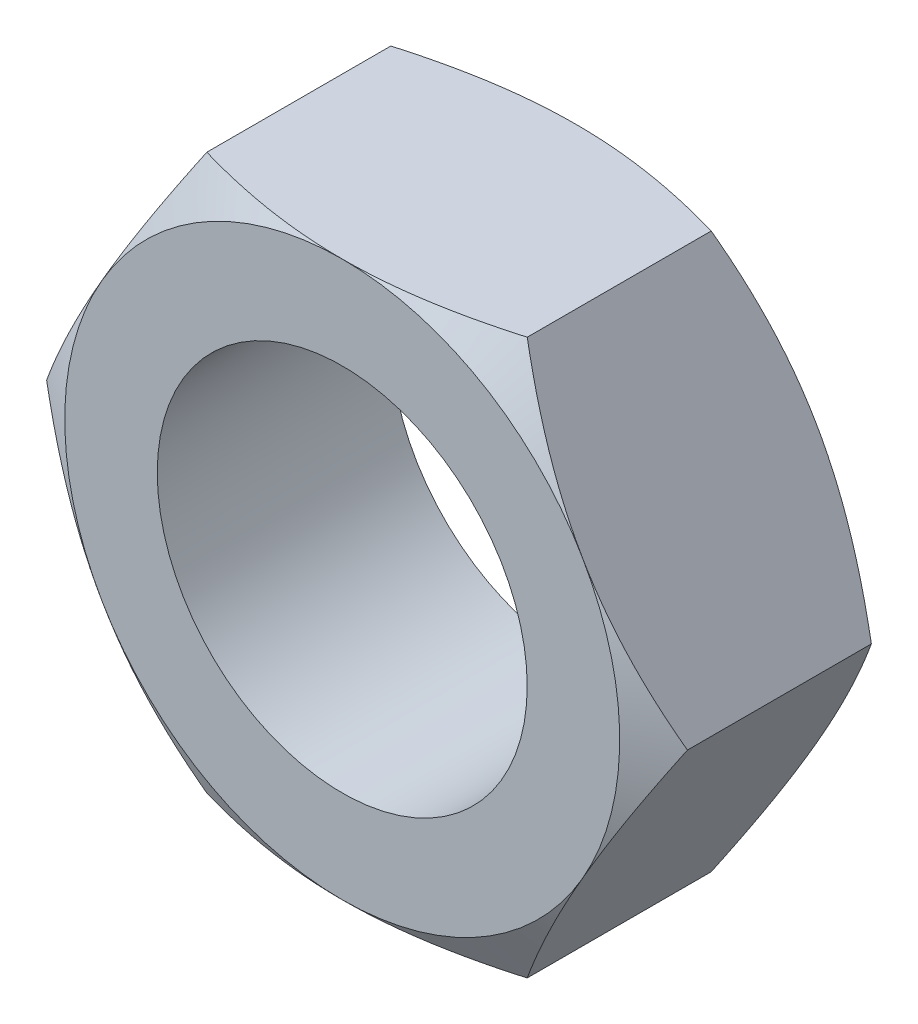
from build123d import *

# Parameters (mm, degrees)
BOSS_EXTRUDE1_DEPTH = 10.1
SKETCH2_OUTSIDE_W   = 113.28
SKETCH2_OUTSIDE_H   = 109.568
SKETCH2_OUTSIDE_R   = 12
CUT_EXTRUDE1_DEPTH  = 21.928688444
CUT_EXTRUDE1_DRAFT  = -60
SKETCH8_R           = 8
CUT_EXTRUDE4_DEPTH  = 21.928688444
SKETCH9_OUTSIDE_W   = 113.28
SKETCH9_OUTSIDE_H   = 109.568
SKETCH9_OUTSIDE_R   = 12
CUT_EXTRUDE6_DEPTH  = 21.928688444
CUT_EXTRUDE6_DRAFT  = 60


with BuildPart() as part:
    # Sketch1 → Boss-Extrude1 (new body)
    with BuildSketch(Plane.XY):
        Polygon((13.856406461, 0), (6.92820323, 12), (-6.92820323, 12), (-13.856406461, 0), (-6.92820323, -12), (6.92820323, -12), align=None)
    extrude(amount=BOSS_EXTRUDE1_DEPTH)


with BuildPart() as cut_extrude1_tool:
    # Sketch2 outside → Cut-Extrude1 (with draft: the straight prism first)
    with BuildSketch(Plane.XY.offset(10.1)):
        Rectangle(SKETCH2_OUTSIDE_W, SKETCH2_OUTSIDE_H)
        Circle(SKETCH2_OUTSIDE_R, mode=Mode.SUBTRACT)
    extrude(amount=-CUT_EXTRUDE1_DEPTH)
    # Cut-Extrude1: the draft: its side faces are tilted about the plane it starts from
    cut_extrude1_sides = [cut_extrude1_tool.faces().sort_by_distance(p)[0] for p in [
        (0, -54.784, -0.864344222),
        (56.64, 0, -0.864344222),
        (0, 54.784, -0.864344222),
        (-56.64, 0, -0.864344222),
        (-12, 0, -0.864344222),
    ]]
    draft(cut_extrude1_sides, Plane.XY.offset(10.1), CUT_EXTRUDE1_DRAFT)


with BuildPart() as part_1:
    add(part.part)

    # Cut-Extrude1: cut by cut_extrude1_tool
    add(cut_extrude1_tool.part, mode=Mode.SUBTRACT)

    # Sketch8 → Cut-Extrude4 (cut, through all)
    with BuildSketch(Plane(origin=(0, 0, 0), x_dir=(-1, 0, 0), z_dir=(0, 0, -1))):
        Circle(SKETCH8_R)
    extrude(amount=-CUT_EXTRUDE4_DEPTH, mode=Mode.SUBTRACT)


with BuildPart() as cut_extrude6_tool:
    # Sketch9 outside → Cut-Extrude6 (with draft: the straight prism first)
    with BuildSketch(Plane.XY):
        Rectangle(SKETCH9_OUTSIDE_W, SKETCH9_OUTSIDE_H)
        Circle(SKETCH9_OUTSIDE_R, mode=Mode.SUBTRACT)
    extrude(amount=CUT_EXTRUDE6_DEPTH)
    # Cut-Extrude6: the draft: its side faces are tilted about the plane it starts from
    cut_extrude6_sides = [cut_extrude6_tool.faces().sort_by_distance(p)[0] for p in [
        (0, -54.784, 10.964344222),
        (56.64, 0, 10.964344222),
        (0, 54.784, 10.964344222),
        (-56.64, 0, 10.964344222),
        (-12, 0, 10.964344222),
    ]]
    draft(cut_extrude6_sides, Plane.XY, CUT_EXTRUDE6_DRAFT)


with BuildPart() as part_2:
    add(part_1.part)

    # Cut-Extrude6: cut by cut_extrude6_tool
    add(cut_extrude6_tool.part, mode=Mode.SUBTRACT)


solid = part_2.part
